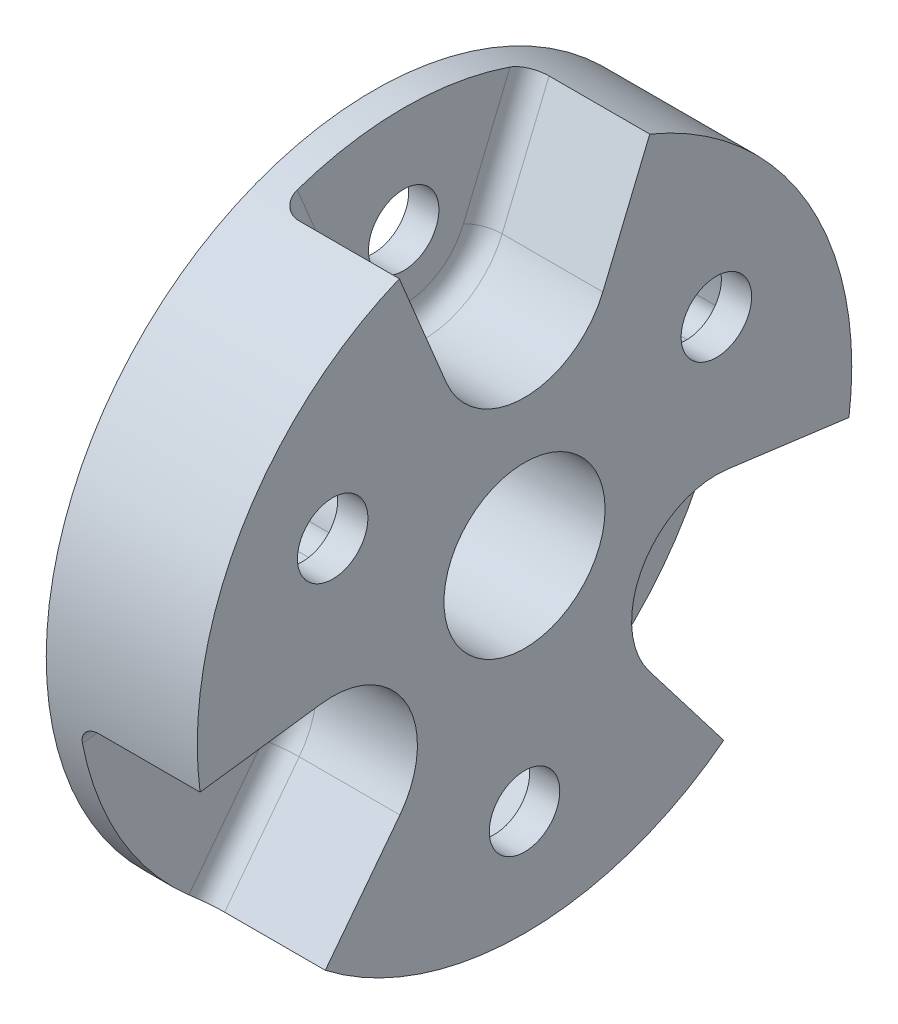
from build123d import *

# Parameters (mm, degrees)
SKETCH1_R           = 32.5
BOSS_EXTRUDE1_DEPTH = 15
CUT_EXTRUDE1_START  = -12
SKETCH2_R           = 3.4999999999999996
SKETCH2_R_2         = 3.5000000000000027
SKETCH2_R_3         = 3.5
CUT_EXTRUDE1_DEPTH  = 12
SKETCH2_3_R         = 3.4999999999999996
SKETCH2_3_R_2       = 3.5
SKETCH2_3_R_3       = 3.5000000000000004
SKETCH2_3_R_4       = 8
SKETCH2_3_R_5       = 3.5000000000000027
SKETCH2_3_R_6       = 3.499999999999997
CUT_EXTRUDE2_DEPTH  = 49.34769901453429
CUT_EXTRUDE3_START  = -3
SKETCH2_4_R         = 3.5000000000000004
SKETCH2_4_R_2       = 3.499999999999997
SKETCH2_4_R_3       = 3.4999999999999996
CUT_EXTRUDE3_DEPTH  = 12
FILLET1_R           = 2
FILLET2_R           = 2


with BuildPart() as part:
    # Sketch1 → Boss-Extrude1 (new body)
    with BuildSketch(Plane(origin=(0, 0, 0), x_dir=(0, 0, -1), z_dir=(1, 0, 0))):
        Circle(SKETCH1_R)
    extrude(amount=BOSS_EXTRUDE1_DEPTH)

    # Sketch2 → Cut-Extrude1 (cut)
    # profile 1 of 6: a face of its own
    with BuildSketch(Plane(origin=(15, 0, 0), x_dir=(0, 0, -1), z_dir=(1, 0, 0)).offset(CUT_EXTRUDE1_START)):
        with BuildLine():
            ThreePointArc((11.28916125477069, 27.254446209082744), (-1.129e-14, 29.500000000000007), (-11.289161254770706, 27.254446209082737))
            Line((-11.289161254770068, 27.254446209083), (-7.778174593051978, 18.778174593052064))
            ThreePointArc((-7.778174593051979, 18.778174593052064), (4.4e-16, 13.580964487968082), (7.778174593051979, 18.778174593052064))
            Line((7.778174593051979, 18.778174593052064), (11.289161254770068, 27.254446209083))
        make_face()
        with Locations((0, 22)):
            Circle(SKETCH2_R, mode=Mode.SUBTRACT)
    # profile 2 of 6: a face of its own
    with BuildSketch(Plane(origin=(15, 0, 0), x_dir=(0, 0, -1), z_dir=(1, 0, 0)).offset(CUT_EXTRUDE1_START)):
        with BuildLine():
            ThreePointArc((12.437211551865326, 30.026084806616858), (1.99e-15, 32.5), (-12.43721155186533, 30.026084806616854))
            Line((-12.437211551865326, 30.02608480661686), (-11.289161254770068, 27.254446209083))
            ThreePointArc((-11.289161254770706, 27.254446209082737), (-1.129e-14, 29.500000000000007), (11.28916125477069, 27.254446209082744))
            Line((11.289161254770068, 27.254446209083), (12.437211551865326, 30.02608480661686))
        make_face()
    # profile 3 of 6: a face of its own
    with BuildSketch(Plane(origin=(15, 0, 0), x_dir=(0, 0, -1), z_dir=(1, 0, 0)).offset(CUT_EXTRUDE1_START)):
        with BuildLine():
            ThreePointArc((17.95846215575803, -23.403923538590853), (25.54774941164132, -14.749999999999359), (29.24762341052748, -3.8505226704910056))
            Line((29.247623410527453, -3.8505226704912214), (20.15146353080865, -2.652990503871945))
            ThreePointArc((20.15146353080865, -2.652990503871946), (11.76146025447474, -6.790482243983657), (12.373288937756671, -16.12518408917935))
            Line((12.373288937756673, -16.12518408917935), (17.95846215575756, -23.40392353859122))
        make_face()
        with Locations((19.052558883257603, -11.00000000000009)):
            Circle(SKETCH2_R_2, mode=Mode.SUBTRACT)
    # profile 4 of 6: a face of its own
    with BuildSketch(Plane(origin=(15, 0, 0), x_dir=(0, 0, -1), z_dir=(1, 0, 0)).offset(CUT_EXTRUDE1_START)):
        with BuildLine():
            ThreePointArc((19.784746442783717, -25.783983559464914), (28.14582562299442, -16.249999999999716), (32.221957994648875, -4.2421012471513935))
            Line((32.22195799464888, -4.2421012471513855), (29.247623410527453, -3.8505226704912214))
            ThreePointArc((29.24762341052748, -3.8505226704910056), (25.54774941164132, -14.749999999999359), (17.95846215575803, -23.403923538590853))
            Line((17.95846215575756, -23.40392353859122), (19.784746442783568, -25.783983559464705))
        make_face()
    # profile 5 of 6: a face of its own
    with BuildSketch(Plane(origin=(15, 0, 0), x_dir=(0, 0, -1), z_dir=(1, 0, 0)).offset(CUT_EXTRUDE1_START)):
        with BuildLine():
            Line((-20.151463530808236, -2.6529905038722004), (-29.247623410527417, -3.850522670491535))
            ThreePointArc((-29.247623410527435, -3.8505226704913462), (-25.547749411641114, -14.749999999999712), (-17.958462155757644, -23.40392353859115))
            Line((-17.958462155757164, -23.403923538591517), (-12.373288937756246, -16.1251840891796))
            ThreePointArc((-12.373288937756246, -16.1251840891796), (-11.761460254474313, -6.790482243983901), (-20.151463530808233, -2.6529905038722))
        make_face()
        with Locations((-19.05255888325775, -10.999999999999824)):
            Circle(SKETCH2_R_3, mode=Mode.SUBTRACT)
    # profile 6 of 6: a face of its own
    with BuildSketch(Plane(origin=(15, 0, 0), x_dir=(0, 0, -1), z_dir=(1, 0, 0)).offset(CUT_EXTRUDE1_START)):
        with BuildLine():
            Line((-29.247623410527417, -3.850522670491535), (-32.22195799464848, -4.242101247151654))
            ThreePointArc((-32.22195799464884, -4.242101247151697), (-28.145825622994227, -16.250000000000053), (-19.784746442783337, -25.78398355946521))
            Line((-19.784746442783135, -25.78398355946496), (-17.958462155757164, -23.403923538591517))
            ThreePointArc((-17.958462155757644, -23.40392353859115), (-25.547749411641114, -14.749999999999712), (-29.247623410527435, -3.8505226704913462))
        make_face()
    extrude(amount=CUT_EXTRUDE1_DEPTH, mode=Mode.SUBTRACT)

    # Sketch2<3> → Cut-Extrude2 (cut, through all)
    with BuildSketch(Plane(origin=(15, 0, 0), x_dir=(0, 0, -1), z_dir=(1, 0, 0))):
        with Locations((0, 22)):
            Circle(SKETCH2_3_R)
        with Locations((-19.05255888325775, -10.999999999999824)):
            Circle(SKETCH2_3_R_2)
        with Locations((-19.052558883257518, 11.000000000000222)):
            Circle(SKETCH2_3_R_3)
        with Locations((-1.5363e-13, -22)):
            Circle(SKETCH2_3_R)
        Circle(SKETCH2_3_R_4)
        with Locations((19.052558883257603, -11.00000000000009)):
            Circle(SKETCH2_3_R_5)
        with Locations((19.052558883257678, 10.999999999999956)):
            Circle(SKETCH2_3_R_6)
    extrude(amount=-CUT_EXTRUDE2_DEPTH, mode=Mode.SUBTRACT)

    # Sketch2<4> → Cut-Extrude3 (cut)
    # profile 1 of 3: a face of its own
    with BuildSketch(Plane(origin=(15, 0, 0), x_dir=(0, 0, -1), z_dir=(1, 0, 0)).offset(CUT_EXTRUDE3_START)):
        with BuildLine():
            Line((-6.82157936914438, 8.629371640534654), (-14.002272700359109, 25.965098867995444))
            ThreePointArc((-14.002272700359109, 25.965098867995447), (-25.547749411640947, 14.750000000000002), (-29.487571581638182, -0.8562255647694067))
            Line((-29.48757158163818, -0.856225564769413), (-10.884044743972197, 1.5929752073435244))
            ThreePointArc((-10.8840447439722, 1.5929752073435248), (-9.526279441628827, 5.499999999999997), (-6.821579369144381, 8.629371640534655))
        make_face()
        with Locations((-19.052558883257518, 11.000000000000222)):
            Circle(SKETCH2_4_R, mode=Mode.SUBTRACT)
    # profile 2 of 3: a face of its own
    with BuildSketch(Plane(origin=(15, 0, 0), x_dir=(0, 0, -1), z_dir=(1, 0, 0)).offset(CUT_EXTRUDE3_START)):
        with BuildLine():
            ThreePointArc((29.500000000000007, 0), (25.330979498043472, 15.119241967430169), (14.002272700359221, 25.965098867995387))
            Line((14.002272700359223, 25.96509886799539), (6.821579369144417, 8.629371640534625))
            ThreePointArc((6.821579369144417, 8.629371640534627), (9.526279441628848, 5.499999999999957), (10.884044743972204, 1.5929752073434809))
            Line((10.884044743972206, 1.5929752073434809), (29.48757158163818, -0.8562255647695387))
            ThreePointArc((29.48757158163818, -0.8562255647695484), (29.496892731763516, -0.42815788073674443), (29.500000000000007, -7.23e-15))
        make_face()
        with Locations((19.052558883257678, 10.999999999999956)):
            Circle(SKETCH2_4_R_2, mode=Mode.SUBTRACT)
    # profile 3 of 3: a face of its own
    with BuildSketch(Plane(origin=(15, 0, 0), x_dir=(0, 0, -1), z_dir=(1, 0, 0)).offset(CUT_EXTRUDE3_START)):
        with BuildLine():
            Line((-4.062465374827911, -10.222346847878146), (-15.485298881279306, -25.1088733032259))
            ThreePointArc((-15.485298881279313, -25.108873303225895), (-2.6743e-13, -29.500000000000007), (15.485298881278835, -25.10887330322619))
            Line((15.485298881278846, -25.108873303226176), (4.062465374827729, -10.222346847878221))
            ThreePointArc((4.062465374827729, -10.222346847878221), (-9.903e-14, -11), (-4.062465374827914, -10.222346847878143))
        make_face()
        with Locations((-1.5363e-13, -22)):
            Circle(SKETCH2_4_R_3, mode=Mode.SUBTRACT)
    extrude(amount=-CUT_EXTRUDE3_DEPTH, mode=Mode.SUBTRACT)

    # Fillet1
    fillet1_edges = [part.edges().sort_by_distance(p)[0] for p in [
        (3, 24.402129699834465, -10.107693072458654),
        (3, 13.580964487968082, -8.9e-16),
        (3, 24.40212969983446, 10.107693072458654),
        (3, -20.95458382432208, -16.079017690270156),
        (3, -6.790482243983657, -11.76146025447474),
        (3, -3.4475458755116675, -26.18671076272876),
        (3, -20.95458382432234, 16.079017690269744),
        (3, -3.447545875511937, 26.18671076272845),
        (3, -6.790482243983902, 11.76146025447431),
    ]]
    fillet(fillet1_edges, radius=FILLET1_R)

    # Fillet2
    fillet2_edges = [part.edges().sort_by_distance(p)[0] for p in [
        (12, -17.6656100755522, -9.773882128053287),
        (6, 25.965098867995387, -14.002272700359221),
        (6, -0.8562255647695436, -29.48757158163818),
        (6, 1.5929752073434806, -10.884044743972208),
        (12, 5.499999999999957, -9.526279441628848),
        (6, 8.629371640534627, -6.821579369144418),
        (12, 0.3683748212869711, -20.185808162805195),
        (12, 14.749999999999888, -25.547749411641007),
        (12, 17.297235254265008, -10.41192603475182),
        (6, -0.8562255647694105, 29.48757158163818),
        (6, 25.965098867995444, 14.002272700359107),
        (6, 8.629371640534655, 6.821579369144381),
        (12, 5.5, 9.526279441628828),
        (6, 1.5929752073435246, 10.884044743972199),
        (12, 17.297235254265047, 10.411926034751744),
        (12, 14.75, 25.547749411640947),
        (12, 0.3683748212870557, 20.185808162805188),
        (6, -25.108873303226183, -15.48529888127884),
        (6, -25.1088733032259, 15.48529888127931),
        (6, -10.222346847878145, 4.062465374827913),
        (12, -11, 1.0059e-13),
        (6, -10.222346847878221, -4.062465374827729),
        (12, -17.665610075552024, 9.773882128053607),
        (12, -29.500000000000007, 2.7933e-13),
    ]]
    fillet(fillet2_edges, radius=FILLET2_R)


solid = part.part
